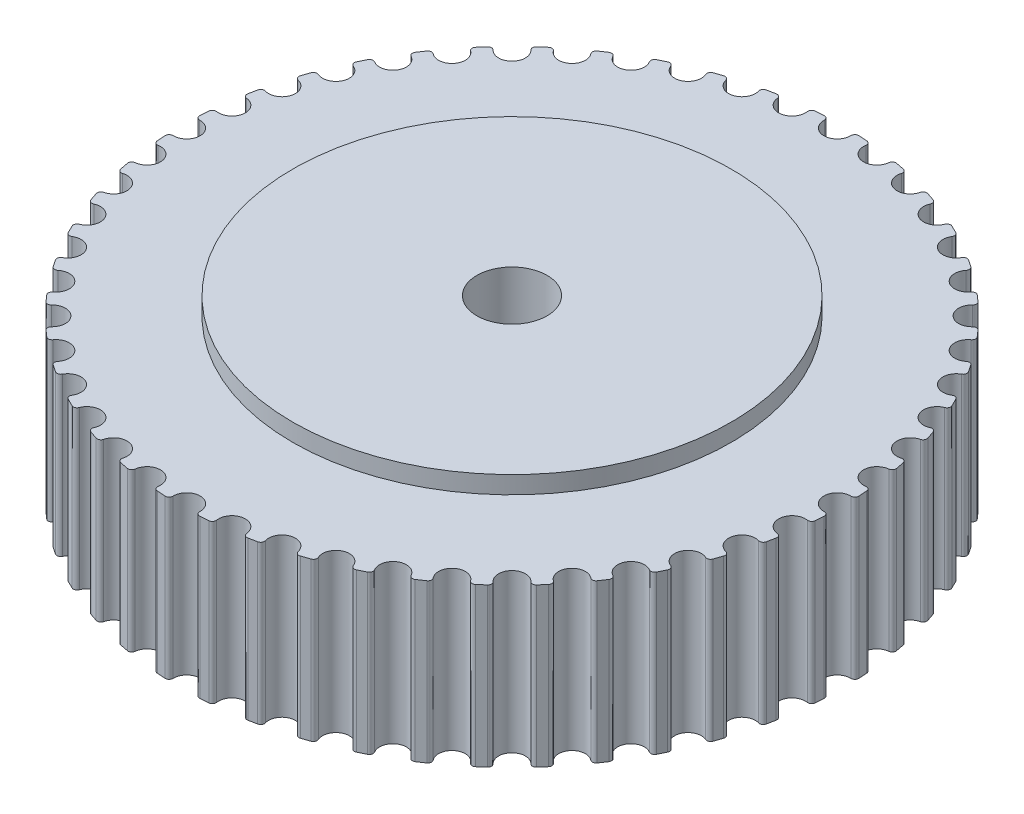
from build123d import *

# Parameters (mm, degrees)
AUFSATZ_LINEAR_AUSTRAGEN1_DEPTH = 18
SKIZZE5_R                       = 25
AUFSATZ_LINEAR_AUSTRAGEN2_DEPTH = 2
F_8_0_8_DURCHMESSER_BOHRUNG1_D  = 8
KREISMUSTER1_COUNT              = 3


with BuildPart() as part:
    # Skizze1 → Aufsatz-Linear austragen1 (new body)
    with BuildSketch(Plane(origin=(0, 0, 0), x_dir=(1, 0, 0), z_dir=(0, 1, 0))):
        with BuildLine():
            Line((1.98238775, 37.572704303), (2.938793876, 37.510018134))
            ThreePointArc((2.938793876, 37.510018134), (3.246775364, 37.349143087), (3.335291888, 37.013139809))
            ThreePointArc((3.335291888, 37.013139809), (3.618732929, 35.861010692), (4.642164026, 35.260736495))
            ThreePointArc((4.642164026, 35.260736495), (5.78608495, 35.575673386), (6.358060929, 36.615184715))
            ThreePointArc((6.358060929, 36.615184715), (6.530525373, 36.916829196), (6.869650172, 36.992511085))
            Line((6.869650172, 36.992511085), (7.809691924, 36.805525155))
            ThreePointArc((7.809691924, 36.805525155), (8.09404018, 36.605826765), (8.137942205, 36.261144317))
            ThreePointArc((8.137942205, 36.261144317), (8.268575342, 35.081875345), (9.204899339, 34.353152012))
            ThreePointArc((9.204899339, 34.353152012), (10.380141373, 34.516082932), (11.082907474, 35.472043251))
            ThreePointArc((11.082907474, 35.472043251), (11.293268967, 35.748595995), (11.639370975, 35.779365746))
            Line((11.639370975, 35.779365746), (12.546963978, 35.471279435))
            ThreePointArc((12.546963978, 35.471279435), (12.802813725, 35.236174598), (12.801350074, 34.888710592))
            ThreePointArc((12.801350074, 34.888710592), (12.776940138, 33.702479384), (13.610136272, 32.857775574))
            ThreePointArc((13.610136272, 32.857775574), (14.7965907, 32.865912729), (15.6181224, 33.721965292))
            ThreePointArc((15.6181224, 33.721965292), (15.862781598, 33.968694404), (16.209938914, 33.954025538))
            Line((16.209938914, 33.954025538), (17.069554, 33.530110291))
            ThreePointArc((17.069554, 33.530110291), (17.292527578, 33.263621714), (17.245723295, 32.919321356))
            ThreePointArc((17.245723295, 32.919321356), (17.066687946, 31.746424656), (17.7825, 30.800193486))
            ThreePointArc((17.7825, 30.800193486), (18.959866258, 30.653397648), (19.886106922, 31.394895158))
            ThreePointArc((19.886106922, 31.394895158), (20.160877638, 31.607579035), (20.503150303, 31.54772254))
            Line((20.503150303, 31.54772254), (21.30007922, 31.015231662))
            ThreePointArc((21.30007922, 31.015231662), (21.486361489, 30.721919041), (21.395017408, 30.386673404))
            ThreePointArc((21.395017408, 30.386673404), (21.064419992, 29.247179801), (21.650600223, 28.215611547))
            ThreePointArc((21.650600223, 28.215611547), (22.798733248, 27.916394434), (23.813834641, 28.530649663))
            ThreePointArc((23.813834641, 28.530649663), (24.114015471, 28.705649225), (24.445547107, 28.601629263))
            Line((24.445547107, 28.601629263), (25.166154179, 27.969673821))
            ThreePointArc((25.166154179, 27.969673821), (25.312557798, 27.654555815), (25.178236842, 27.334101046))
            ThreePointArc((25.178236842, 27.334101046), (24.701733971, 26.24750759), (25.148252673, 25.148252673))
            ThreePointArc((25.148252673, 25.148252673), (26.24750759, 24.701733971), (27.334101046, 25.178236842))
            ThreePointArc((27.334101046, 25.178236842), (27.654555815, 25.312557798), (27.969673821, 25.166154179))
            Line((27.969673821, 25.166154179), (28.601629263, 24.445547107))
            ThreePointArc((28.601629263, 24.445547107), (28.705649225, 24.114015471), (28.530649663, 23.813834641))
            ThreePointArc((28.530649663, 23.813834641), (27.916394434, 22.798733248), (28.215611547, 21.650600223))
            ThreePointArc((28.215611547, 21.650600223), (29.247179801, 21.064419992), (30.386673404, 21.395017408))
            ThreePointArc((30.386673404, 21.395017408), (30.721919041, 21.486361489), (31.015231662, 21.30007922))
            Line((31.015231662, 21.30007922), (31.54772254, 20.503150303))
            ThreePointArc((31.54772254, 20.503150303), (31.607579035, 20.160877638), (31.394895158, 19.886106922))
            ThreePointArc((31.394895158, 19.886106922), (30.653397648, 18.959866258), (30.800193486, 17.7825))
            ThreePointArc((30.800193486, 17.7825), (31.746424656, 17.066687946), (32.919321356, 17.245723295))
            ThreePointArc((32.919321356, 17.245723295), (33.263621714, 17.292527578), (33.530110291, 17.069554))
            Line((33.530110291, 17.069554), (33.954025538, 16.209938914))
            ThreePointArc((33.954025538, 16.209938914), (33.968694404, 15.862781598), (33.721965292, 15.6181224))
            ThreePointArc((33.721965292, 15.6181224), (32.865912729, 14.7965907), (32.857775574, 13.610136272))
            ThreePointArc((32.857775574, 13.610136272), (33.702479384, 12.776940138), (34.888710592, 12.801350074))
            ThreePointArc((34.888710592, 12.801350074), (35.236174598, 12.802813725), (35.471279435, 12.546963978))
            Line((35.471279435, 12.546963978), (35.779365746, 11.639370975))
            ThreePointArc((35.779365746, 11.639370975), (35.748595995, 11.293268967), (35.472043251, 11.082907474))
            ThreePointArc((35.472043251, 11.082907474), (34.516082932, 10.380141373), (34.353152012, 9.204899339))
            ThreePointArc((34.353152012, 9.204899339), (35.081875345, 8.268575342), (36.261144317, 8.137942205))
            ThreePointArc((36.261144317, 8.137942205), (36.605826765, 8.09404018), (36.805525155, 7.809691924))
            Line((36.805525155, 7.809691924), (36.992511085, 6.869650172))
            ThreePointArc((36.992511085, 6.869650172), (36.916829196, 6.530525373), (36.615184715, 6.358060929))
            ThreePointArc((36.615184715, 6.358060929), (35.575673386, 5.78608495), (35.260736495, 4.642164026))
            ThreePointArc((35.260736495, 4.642164026), (35.861010692, 3.618732929), (37.013139809, 3.335291888))
            ThreePointArc((37.013139809, 3.335291888), (37.349143087, 3.246775364), (37.510018134, 2.938793876))
            Line((37.510018134, 2.938793876), (37.572704303, 1.98238775))
            ThreePointArc((37.572704303, 1.98238775), (37.453405215, 1.656042679), (37.131830217, 1.524426198))
            ThreePointArc((37.131830217, 1.524426198), (36.026554205, 1.093027008), (35.565, 0))
            ThreePointArc((35.565, 0), (36.026554205, -1.093027008), (37.131830217, -1.524426198))
            ThreePointArc((37.131830217, -1.524426198), (37.453405215, -1.656042679), (37.572704303, -1.98238775))
            Line((37.572704303, -1.98238775), (37.510018134, -2.938793876))
            ThreePointArc((37.510018134, -2.938793876), (37.349143087, -3.246775364), (37.013139809, -3.335291888))
            ThreePointArc((37.013139809, -3.335291888), (35.861010692, -3.618732929), (35.260736495, -4.642164026))
            ThreePointArc((35.260736495, -4.642164026), (35.575673386, -5.78608495), (36.615184715, -6.358060929))
            ThreePointArc((36.615184715, -6.358060929), (36.916829196, -6.530525373), (36.992511085, -6.869650172))
            Line((36.992511085, -6.869650172), (36.805525155, -7.809691924))
            ThreePointArc((36.805525155, -7.809691924), (36.605826765, -8.09404018), (36.261144317, -8.137942205))
            ThreePointArc((36.261144317, -8.137942205), (35.081875345, -8.268575342), (34.353152012, -9.204899339))
            ThreePointArc((34.353152012, -9.204899339), (34.516082932, -10.380141373), (35.472043251, -11.082907474))
            ThreePointArc((35.472043251, -11.082907474), (35.748595995, -11.293268967), (35.779365746, -11.639370975))
            Line((35.779365746, -11.639370975), (35.471279435, -12.546963978))
            ThreePointArc((35.471279435, -12.546963978), (35.236174598, -12.802813725), (34.888710592, -12.801350074))
            ThreePointArc((34.888710592, -12.801350074), (33.702479384, -12.776940138), (32.857775574, -13.610136272))
            ThreePointArc((32.857775574, -13.610136272), (32.865912729, -14.7965907), (33.721965292, -15.6181224))
            ThreePointArc((33.721965292, -15.6181224), (33.968694404, -15.862781598), (33.954025538, -16.209938914))
            Line((33.954025538, -16.209938914), (33.530110291, -17.069554))
            ThreePointArc((33.530110291, -17.069554), (33.263621714, -17.292527578), (32.919321356, -17.245723295))
            ThreePointArc((32.919321356, -17.245723295), (31.746424656, -17.066687946), (30.800193486, -17.7825))
            ThreePointArc((30.800193486, -17.7825), (30.653397648, -18.959866258), (31.394895158, -19.886106922))
            ThreePointArc((31.394895158, -19.886106922), (31.607579035, -20.160877638), (31.54772254, -20.503150303))
            Line((31.54772254, -20.503150303), (31.015231662, -21.30007922))
            ThreePointArc((31.015231662, -21.30007922), (30.721919041, -21.486361489), (30.386673404, -21.395017408))
            ThreePointArc((30.386673404, -21.395017408), (29.247179801, -21.064419992), (28.215611547, -21.650600223))
            ThreePointArc((28.215611547, -21.650600223), (27.916394434, -22.798733248), (28.530649663, -23.813834641))
            ThreePointArc((28.530649663, -23.813834641), (28.705649225, -24.114015471), (28.601629263, -24.445547107))
            Line((28.601629263, -24.445547107), (27.969673821, -25.166154179))
            ThreePointArc((27.969673821, -25.166154179), (27.654555815, -25.312557798), (27.334101046, -25.178236842))
            ThreePointArc((27.334101046, -25.178236842), (26.24750759, -24.701733971), (25.148252673, -25.148252673))
            ThreePointArc((25.148252673, -25.148252673), (24.701733971, -26.24750759), (25.178236842, -27.334101046))
            ThreePointArc((25.178236842, -27.334101046), (25.312557798, -27.654555815), (25.166154179, -27.969673821))
            Line((25.166154179, -27.969673821), (24.445547107, -28.601629263))
            ThreePointArc((24.445547107, -28.601629263), (24.114015471, -28.705649225), (23.813834641, -28.530649663))
            ThreePointArc((23.813834641, -28.530649663), (22.798733248, -27.916394434), (21.650600223, -28.215611547))
            ThreePointArc((21.650600223, -28.215611547), (21.064419992, -29.247179801), (21.395017408, -30.386673404))
            ThreePointArc((21.395017408, -30.386673404), (21.486361489, -30.721919041), (21.30007922, -31.015231662))
            Line((21.30007922, -31.015231662), (20.503150303, -31.54772254))
            ThreePointArc((20.503150303, -31.54772254), (20.160877638, -31.607579035), (19.886106922, -31.394895158))
            ThreePointArc((19.886106922, -31.394895158), (18.959866258, -30.653397648), (17.7825, -30.800193486))
            ThreePointArc((17.7825, -30.800193486), (17.066687946, -31.746424656), (17.245723295, -32.919321356))
            ThreePointArc((17.245723295, -32.919321356), (17.292527578, -33.263621714), (17.069554, -33.530110291))
            Line((17.069554, -33.530110291), (16.209938914, -33.954025538))
            ThreePointArc((16.209938914, -33.954025538), (15.862781598, -33.968694404), (15.6181224, -33.721965292))
            ThreePointArc((15.6181224, -33.721965292), (14.7965907, -32.865912729), (13.610136272, -32.857775574))
            ThreePointArc((13.610136272, -32.857775574), (12.776940138, -33.702479384), (12.801350074, -34.888710592))
            ThreePointArc((12.801350074, -34.888710592), (12.802813725, -35.236174598), (12.546963978, -35.471279435))
            Line((12.546963978, -35.471279435), (11.639370975, -35.779365746))
            ThreePointArc((11.639370975, -35.779365746), (11.293268967, -35.748595995), (11.082907474, -35.472043251))
            ThreePointArc((11.082907474, -35.472043251), (10.380141373, -34.516082932), (9.204899339, -34.353152012))
            ThreePointArc((9.204899339, -34.353152012), (8.268575342, -35.081875345), (8.137942205, -36.261144317))
            ThreePointArc((8.137942205, -36.261144317), (8.09404018, -36.605826765), (7.809691924, -36.805525155))
            Line((7.809691924, -36.805525155), (6.869650172, -36.992511085))
            ThreePointArc((6.869650172, -36.992511085), (6.530525373, -36.916829196), (6.358060929, -36.615184715))
            ThreePointArc((6.358060929, -36.615184715), (5.78608495, -35.575673386), (4.642164026, -35.260736495))
            ThreePointArc((4.642164026, -35.260736495), (3.618732929, -35.861010692), (3.335291888, -37.013139809))
            ThreePointArc((3.335291888, -37.013139809), (3.246775364, -37.349143087), (2.938793876, -37.510018134))
            Line((2.938793876, -37.510018134), (1.98238775, -37.572704303))
            ThreePointArc((1.98238775, -37.572704303), (1.656042679, -37.453405215), (1.524426198, -37.131830217))
            ThreePointArc((1.524426198, -37.131830217), (1.093027008, -36.026554205), (0, -35.565))
            ThreePointArc((0, -35.565), (-1.093027008, -36.026554205), (-1.524426198, -37.131830217))
            ThreePointArc((-1.524426198, -37.131830217), (-1.656042679, -37.453405215), (-1.98238775, -37.572704303))
            Line((-1.98238775, -37.572704303), (-2.938793876, -37.510018134))
            ThreePointArc((-2.938793876, -37.510018134), (-3.246775364, -37.349143087), (-3.335291888, -37.013139809))
            ThreePointArc((-3.335291888, -37.013139809), (-3.618732929, -35.861010692), (-4.642164026, -35.260736495))
            ThreePointArc((-4.642164026, -35.260736495), (-5.78608495, -35.575673386), (-6.358060929, -36.615184715))
            ThreePointArc((-6.358060929, -36.615184715), (-6.530525373, -36.916829196), (-6.869650172, -36.992511085))
            Line((-6.869650172, -36.992511085), (-7.809691924, -36.805525155))
            ThreePointArc((-7.809691924, -36.805525155), (-8.09404018, -36.605826765), (-8.137942205, -36.261144317))
            ThreePointArc((-8.137942205, -36.261144317), (-8.268575342, -35.081875345), (-9.204899339, -34.353152012))
            ThreePointArc((-9.204899339, -34.353152012), (-10.380141373, -34.516082932), (-11.082907474, -35.472043251))
            ThreePointArc((-11.082907474, -35.472043251), (-11.293268967, -35.748595995), (-11.639370975, -35.779365746))
            Line((-11.639370975, -35.779365746), (-12.546963978, -35.471279435))
            ThreePointArc((-12.546963978, -35.471279435), (-12.802813725, -35.236174598), (-12.801350074, -34.888710592))
            ThreePointArc((-12.801350074, -34.888710592), (-12.776940138, -33.702479384), (-13.610136272, -32.857775574))
            ThreePointArc((-13.610136272, -32.857775574), (-14.7965907, -32.865912729), (-15.6181224, -33.721965292))
            ThreePointArc((-15.6181224, -33.721965292), (-15.862781598, -33.968694404), (-16.209938914, -33.954025538))
            Line((-16.209938914, -33.954025538), (-17.069554, -33.530110291))
            ThreePointArc((-17.069554, -33.530110291), (-17.292527578, -33.263621714), (-17.245723295, -32.919321356))
            ThreePointArc((-17.245723295, -32.919321356), (-17.066687946, -31.746424656), (-17.7825, -30.800193486))
            ThreePointArc((-17.7825, -30.800193486), (-18.959866258, -30.653397648), (-19.886106922, -31.394895158))
            ThreePointArc((-19.886106922, -31.394895158), (-20.160877638, -31.607579035), (-20.503150303, -31.54772254))
            Line((-20.503150303, -31.54772254), (-21.30007922, -31.015231662))
            ThreePointArc((-21.30007922, -31.015231662), (-21.486361489, -30.721919041), (-21.395017408, -30.386673404))
            ThreePointArc((-21.395017408, -30.386673404), (-21.064419992, -29.247179801), (-21.650600223, -28.215611547))
            ThreePointArc((-21.650600223, -28.215611547), (-22.798733248, -27.916394434), (-23.813834641, -28.530649663))
            ThreePointArc((-23.813834641, -28.530649663), (-24.114015471, -28.705649225), (-24.445547107, -28.601629263))
            Line((-24.445547107, -28.601629263), (-25.166154179, -27.969673821))
            ThreePointArc((-25.166154179, -27.969673821), (-25.312557798, -27.654555815), (-25.178236842, -27.334101046))
            ThreePointArc((-25.178236842, -27.334101046), (-24.701733971, -26.24750759), (-25.148252673, -25.148252673))
            ThreePointArc((-25.148252673, -25.148252673), (-26.24750759, -24.701733971), (-27.334101046, -25.178236842))
            ThreePointArc((-27.334101046, -25.178236842), (-27.654555815, -25.312557798), (-27.969673821, -25.166154179))
            Line((-27.969673821, -25.166154179), (-28.601629263, -24.445547107))
            ThreePointArc((-28.601629263, -24.445547107), (-28.705649225, -24.114015471), (-28.530649663, -23.813834641))
            ThreePointArc((-28.530649663, -23.813834641), (-27.916394434, -22.798733248), (-28.215611547, -21.650600223))
            ThreePointArc((-28.215611547, -21.650600223), (-29.247179801, -21.064419992), (-30.386673404, -21.395017408))
            ThreePointArc((-30.386673404, -21.395017408), (-30.721919041, -21.486361489), (-31.015231662, -21.30007922))
            Line((-31.015231662, -21.30007922), (-31.54772254, -20.503150303))
            ThreePointArc((-31.54772254, -20.503150303), (-31.607579035, -20.160877638), (-31.394895158, -19.886106922))
            ThreePointArc((-31.394895158, -19.886106922), (-30.653397648, -18.959866258), (-30.800193486, -17.7825))
            ThreePointArc((-30.800193486, -17.7825), (-31.746424656, -17.066687946), (-32.919321356, -17.245723295))
            ThreePointArc((-32.919321356, -17.245723295), (-33.263621714, -17.292527578), (-33.530110291, -17.069554))
            Line((-33.530110291, -17.069554), (-33.954025538, -16.209938914))
            ThreePointArc((-33.954025538, -16.209938914), (-33.968694404, -15.862781598), (-33.721965292, -15.6181224))
            ThreePointArc((-33.721965292, -15.6181224), (-32.865912729, -14.7965907), (-32.857775574, -13.610136272))
            ThreePointArc((-32.857775574, -13.610136272), (-33.702479384, -12.776940138), (-34.888710592, -12.801350074))
            ThreePointArc((-34.888710592, -12.801350074), (-35.236174598, -12.802813725), (-35.471279435, -12.546963978))
            Line((-35.471279435, -12.546963978), (-35.779365746, -11.639370975))
            ThreePointArc((-35.779365746, -11.639370975), (-35.748595995, -11.293268967), (-35.472043251, -11.082907474))
            ThreePointArc((-35.472043251, -11.082907474), (-34.516082932, -10.380141373), (-34.353152012, -9.204899339))
            ThreePointArc((-34.353152012, -9.204899339), (-35.081875345, -8.268575342), (-36.261144317, -8.137942205))
            ThreePointArc((-36.261144317, -8.137942205), (-36.605826765, -8.09404018), (-36.805525155, -7.809691924))
            Line((-36.805525155, -7.809691924), (-36.992511085, -6.869650172))
            ThreePointArc((-36.992511085, -6.869650172), (-36.916829196, -6.530525373), (-36.615184715, -6.358060929))
            ThreePointArc((-36.615184715, -6.358060929), (-35.575673386, -5.78608495), (-35.260736495, -4.642164026))
            ThreePointArc((-35.260736495, -4.642164026), (-35.861010692, -3.618732929), (-37.013139809, -3.335291888))
            ThreePointArc((-37.013139809, -3.335291888), (-37.349143087, -3.246775364), (-37.510018134, -2.938793876))
            Line((-37.510018134, -2.938793876), (-37.572704303, -1.98238775))
            ThreePointArc((-37.572704303, -1.98238775), (-37.453405215, -1.656042679), (-37.131830217, -1.524426198))
            ThreePointArc((-37.131830217, -1.524426198), (-36.026554205, -1.093027008), (-35.565, 0))
            ThreePointArc((-35.565, 0), (-36.026554205, 1.093027008), (-37.131830217, 1.524426198))
            ThreePointArc((-37.131830217, 1.524426198), (-37.453405215, 1.656042679), (-37.572704303, 1.98238775))
            Line((-37.572704303, 1.98238775), (-37.510018134, 2.938793876))
            ThreePointArc((-37.510018134, 2.938793876), (-37.349143087, 3.246775364), (-37.013139809, 3.335291888))
            ThreePointArc((-37.013139809, 3.335291888), (-35.861010692, 3.618732929), (-35.260736495, 4.642164026))
            ThreePointArc((-35.260736495, 4.642164026), (-35.575673386, 5.78608495), (-36.615184715, 6.358060929))
            ThreePointArc((-36.615184715, 6.358060929), (-36.916829196, 6.530525373), (-36.992511085, 6.869650172))
            Line((-36.992511085, 6.869650172), (-36.805525155, 7.809691924))
            ThreePointArc((-36.805525155, 7.809691924), (-36.605826765, 8.09404018), (-36.261144317, 8.137942205))
            ThreePointArc((-36.261144317, 8.137942205), (-35.081875345, 8.268575342), (-34.353152012, 9.204899339))
            ThreePointArc((-34.353152012, 9.204899339), (-34.516082932, 10.380141373), (-35.472043251, 11.082907474))
            ThreePointArc((-35.472043251, 11.082907474), (-35.748595995, 11.293268967), (-35.779365746, 11.639370975))
            Line((-35.779365746, 11.639370975), (-35.471279435, 12.546963978))
            ThreePointArc((-35.471279435, 12.546963978), (-35.236174598, 12.802813725), (-34.888710592, 12.801350074))
            ThreePointArc((-34.888710592, 12.801350074), (-33.702479384, 12.776940138), (-32.857775574, 13.610136272))
            ThreePointArc((-32.857775574, 13.610136272), (-32.865912729, 14.7965907), (-33.721965292, 15.6181224))
            ThreePointArc((-33.721965292, 15.6181224), (-33.968694404, 15.862781598), (-33.954025538, 16.209938914))
            Line((-33.954025538, 16.209938914), (-33.530110291, 17.069554))
            ThreePointArc((-33.530110291, 17.069554), (-33.263621714, 17.292527578), (-32.919321356, 17.245723295))
            ThreePointArc((-32.919321356, 17.245723295), (-31.746424656, 17.066687946), (-30.800193486, 17.7825))
            ThreePointArc((-30.800193486, 17.7825), (-30.653397648, 18.959866258), (-31.394895158, 19.886106922))
            ThreePointArc((-31.394895158, 19.886106922), (-31.607579035, 20.160877638), (-31.54772254, 20.503150303))
            Line((-31.54772254, 20.503150303), (-31.015231662, 21.30007922))
            ThreePointArc((-31.015231662, 21.30007922), (-30.721919041, 21.486361489), (-30.386673404, 21.395017408))
            ThreePointArc((-30.386673404, 21.395017408), (-29.247179801, 21.064419992), (-28.215611547, 21.650600223))
            ThreePointArc((-28.215611547, 21.650600223), (-27.916394434, 22.798733248), (-28.530649663, 23.813834641))
            ThreePointArc((-28.530649663, 23.813834641), (-28.705649225, 24.114015471), (-28.601629263, 24.445547107))
            Line((-28.601629263, 24.445547107), (-27.969673821, 25.166154179))
            ThreePointArc((-27.969673821, 25.166154179), (-27.654555815, 25.312557798), (-27.334101046, 25.178236842))
            ThreePointArc((-27.334101046, 25.178236842), (-26.24750759, 24.701733971), (-25.148252673, 25.148252673))
            ThreePointArc((-25.148252673, 25.148252673), (-24.701733971, 26.24750759), (-25.178236842, 27.334101046))
            ThreePointArc((-25.178236842, 27.334101046), (-25.312557798, 27.654555815), (-25.166154179, 27.969673821))
            Line((-25.166154179, 27.969673821), (-24.445547107, 28.601629263))
            ThreePointArc((-24.445547107, 28.601629263), (-24.114015471, 28.705649225), (-23.813834641, 28.530649663))
            ThreePointArc((-23.813834641, 28.530649663), (-22.798733248, 27.916394434), (-21.650600223, 28.215611547))
            ThreePointArc((-21.650600223, 28.215611547), (-21.064419992, 29.247179801), (-21.395017408, 30.386673404))
            ThreePointArc((-21.395017408, 30.386673404), (-21.486361489, 30.721919041), (-21.30007922, 31.015231662))
            Line((-21.30007922, 31.015231662), (-20.503150303, 31.54772254))
            ThreePointArc((-20.503150303, 31.54772254), (-20.160877638, 31.607579035), (-19.886106922, 31.394895158))
            ThreePointArc((-19.886106922, 31.394895158), (-18.959866258, 30.653397648), (-17.7825, 30.800193486))
            ThreePointArc((-17.7825, 30.800193486), (-17.066687946, 31.746424656), (-17.245723295, 32.919321356))
            ThreePointArc((-17.245723295, 32.919321356), (-17.292527578, 33.263621714), (-17.069554, 33.530110291))
            Line((-17.069554, 33.530110291), (-16.209938914, 33.954025538))
            ThreePointArc((-16.209938914, 33.954025538), (-15.862781598, 33.968694404), (-15.6181224, 33.721965292))
            ThreePointArc((-15.6181224, 33.721965292), (-14.7965907, 32.865912729), (-13.610136272, 32.857775574))
            ThreePointArc((-13.610136272, 32.857775574), (-12.776940138, 33.702479384), (-12.801350074, 34.888710592))
            ThreePointArc((-12.801350074, 34.888710592), (-12.802813725, 35.236174598), (-12.546963978, 35.471279435))
            Line((-12.546963978, 35.471279435), (-11.639370975, 35.779365746))
            ThreePointArc((-11.639370975, 35.779365746), (-11.293268967, 35.748595995), (-11.082907474, 35.472043251))
            ThreePointArc((-11.082907474, 35.472043251), (-10.380141373, 34.516082932), (-9.204899339, 34.353152012))
            ThreePointArc((-9.204899339, 34.353152012), (-8.268575342, 35.081875345), (-8.137942205, 36.261144317))
            ThreePointArc((-8.137942205, 36.261144317), (-8.09404018, 36.605826765), (-7.809691924, 36.805525155))
            Line((-7.809691924, 36.805525155), (-6.869650172, 36.992511085))
            ThreePointArc((-6.869650172, 36.992511085), (-6.530525373, 36.916829196), (-6.358060929, 36.615184715))
            ThreePointArc((-6.358060929, 36.615184715), (-5.78608495, 35.575673386), (-4.642164026, 35.260736495))
            ThreePointArc((-4.642164026, 35.260736495), (-3.618732929, 35.861010692), (-3.335291888, 37.013139809))
            ThreePointArc((-3.335291888, 37.013139809), (-3.246775364, 37.349143087), (-2.938793876, 37.510018134))
            Line((-2.938793876, 37.510018134), (-1.98238775, 37.572704303))
            ThreePointArc((-1.98238775, 37.572704303), (-1.656042679, 37.453405215), (-1.524426198, 37.131830217))
            ThreePointArc((-1.524426198, 37.131830217), (-1.093027008, 36.026554205), (0, 35.565))
            ThreePointArc((0, 35.565), (1.093027008, 36.026554205), (1.524426198, 37.131830217))
            ThreePointArc((1.524426198, 37.131830217), (1.656042679, 37.453405215), (1.98238775, 37.572704303))
        make_face()
    extrude(amount=AUFSATZ_LINEAR_AUSTRAGEN1_DEPTH)

    # Skizze5 → Aufsatz-Linear austragen2 (add)
    with BuildSketch(Plane(origin=(0, 18, 0), x_dir=(1, 0, 0), z_dir=(0, 1, 0))):
        with Locations(Location((0, 0, 0), (0, 0, 270))):
            Circle(SKIZZE5_R)
    extrude(amount=AUFSATZ_LINEAR_AUSTRAGEN2_DEPTH)

    # Skizze6 → Rotation1 (revolve)
    with BuildSketch(Plane.XY, mode=Mode.PRIVATE) as rotation1_sk:
        Polygon((0, -12), (12, -12), (12, -2), (25, -2), (25, 0), (0, 0), align=None)
    revolve(rotation1_sk.sketch.rotate(Axis((0, 0, 0), (0, -1, 0)), 90), axis=Axis((0, 0, 0), (0, -1, 0)))

    # Ø8.0 (8) Durchmesser Bohrung1 (through all)
    with Locations(Plane(origin=(0, 20, 0), x_dir=(1, 0, 0), z_dir=(0, 1, 0))):
        with Locations((0, 0)):
            Hole(F_8_0_8_DURCHMESSER_BOHRUNG1_D / 2)

    # Skizze10 → Ø3.1 (3.1) Durchmesser Bohrung1 (revolve, cut)
    with BuildSketch(Plane.ZX.offset(-7)):
        Polygon((0, 0), (0, 17.931333959), (1.55, 17), (1.55, 0), align=None)
    f_3_1_3_1_durchmesser_bohrung1 = revolve(axis=Axis((-6.35, -7, 0), (1, 0, 0)), mode=Mode.SUBTRACT)

    # Kreismuster1: Ø3.1 (3.1) Durchmesser Bohrung1 ×3 about axis
    kreismuster1_axis = Axis((0, 0, 0), (0, 1, 0))
    for i in range(1, KREISMUSTER1_COUNT):
        add(f_3_1_3_1_durchmesser_bohrung1.rotate(kreismuster1_axis, i * 360 / KREISMUSTER1_COUNT), mode=Mode.SUBTRACT)


solid = part.part
